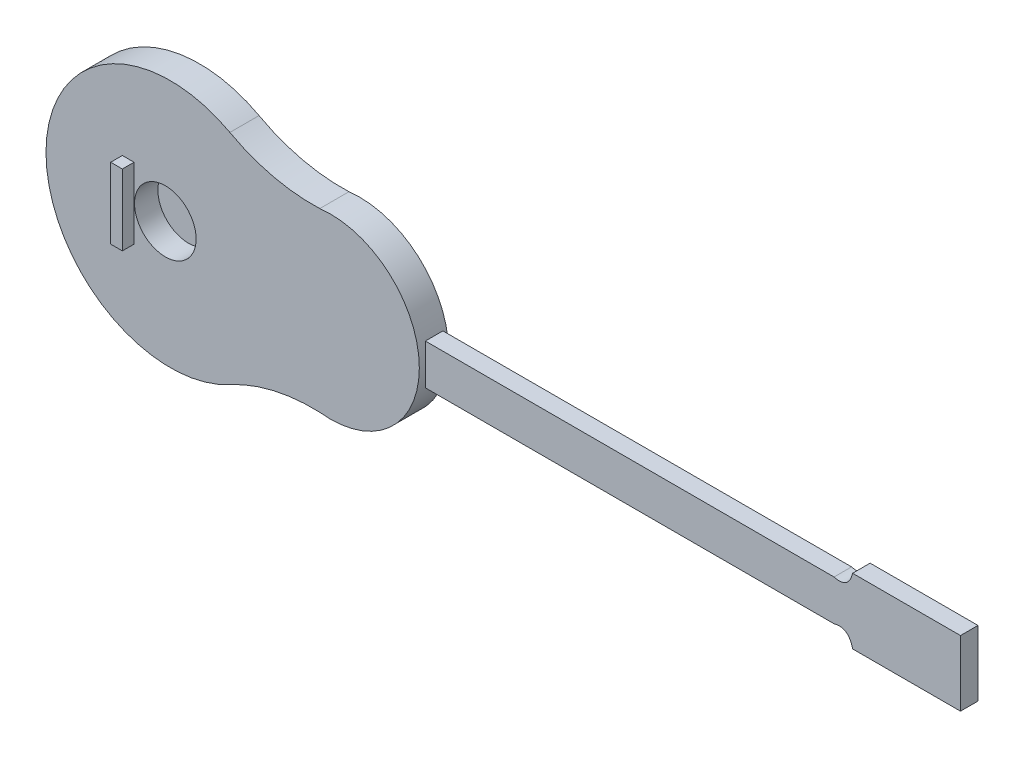
from build123d import *

# Parameters (mm, degrees)
BOSS_EXTRUDE1_DEPTH = 5
SKETCH2_R           = 5.278550586
CUT_EXTRUDE1_DEPTH  = 4
SKETCH3_W           = 2
SKETCH3_H           = 12.154507728
BOSS_EXTRUDE2_DEPTH = 2
SKETCH4_W           = 3
SKETCH4_H           = 6.940968586
BOSS_EXTRUDE3_DEPTH = 70
BOSS_EXTRUDE4_DEPTH = 3
SCALE4_SCALE        = 0.5


with BuildPart() as part:
    # Sketch1 → Boss-Extrude1 (new body)
    with BuildSketch(Plane.XY):
        with BuildLine():
            ThreePointArc((5.174427841, 18.704119042), (-26.317863295, 0), (5.174427841, -18.704119042))
            ThreePointArc((5.174427841, -18.704119042), (12.632543097, -15.862864713), (20.57819755, -15.112674975))
            ThreePointArc((20.57819755, -15.112674975), (37.627690387, 0), (20.57819755, 15.112674975))
            ThreePointArc((20.57819755, 15.112674975), (12.632543097, 15.862864713), (5.174427841, 18.704119042))
        make_face()
    extrude(amount=BOSS_EXTRUDE1_DEPTH)

    # Sketch2 → Cut-Extrude1 (cut)
    with BuildSketch(Plane.XY.offset(5)):
        with Locations((-5.878799432, 0)):
            Circle(SKETCH2_R)
    extrude(amount=-CUT_EXTRUDE1_DEPTH, mode=Mode.SUBTRACT)

    # Sketch3 → Boss-Extrude2 (add)
    with BuildSketch(Plane.XY.offset(5)):
        with Locations((-12.237238322, 0)):
            Rectangle(SKETCH3_W, SKETCH3_H)
    extrude(amount=BOSS_EXTRUDE2_DEPTH)


with BuildPart() as body_2:
    # Sketch4 → Boss-Extrude3 (new body)
    with BuildSketch(Plane(origin=(37.627690387, 0, 0), x_dir=(0, 0, -1), z_dir=(1, 0, 0))):
        with Locations((-2.464797003, 0)):
            Rectangle(SKETCH4_W, SKETCH4_H)
    extrude(amount=BOSS_EXTRUDE3_DEPTH)

    # Sketch5 → Boss-Extrude4 (add)
    with BuildSketch(Plane.XY.offset(3.964797003)):
        with BuildLine():
            Line((110.806298468, 5.612110794), (129.285199862, 5.612110794))
            Line((129.285199862, 5.612110794), (129.285199862, -5.612110794))
            Line((129.285199862, -5.612110794), (110.806298468, -5.612110794))
            add(Edge.make_bspline(
                [(107.627690387, -3.470484293), (110.128503365, -2.786214219), (110.806298468, -5.612110794)],
                knots=[0, 0, 0, 1, 1, 1], degree=2))
            Line((107.627690387, -3.470484293), (107.627690387, 3.470484293))
            add(Edge.make_bspline(
                [(107.627690387, 3.470484293), (110.128503365, 2.786214219), (110.806298468, 5.612110794)],
                knots=[0, 0, 0, 1, 1, 1], degree=2))
        make_face()
    extrude(amount=-BOSS_EXTRUDE4_DEPTH)


with BuildPart() as part_1:
    # Scale4: scaled about (0, 0, 0)
    add(part.part.scale(SCALE4_SCALE))


with BuildPart() as body_2_1:
    # Scale4: scaled about (0, 0, 0)
    add(body_2.part.scale(SCALE4_SCALE))


solid = Compound([part_1.part, body_2_1.part])
